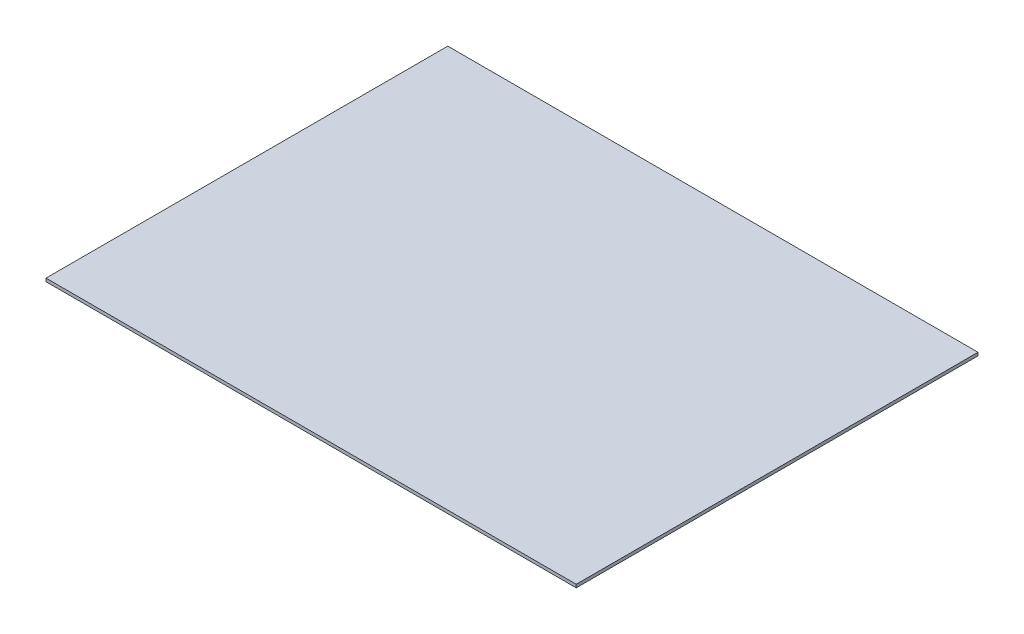
from build123d import *

# Parameters (mm, degrees)
SKETCH1_W           = 536.999999944
SKETCH1_H           = 406.908
BOSS_EXTRUDE1_DEPTH = 3.175


with BuildPart() as part:
    # Sketch1 → Boss-Extrude1 (new body)
    with BuildSketch(Plane(origin=(0, 0, 0), x_dir=(1, 0, 0), z_dir=(0, 1, 0))):
        Rectangle(SKETCH1_W, SKETCH1_H)
    extrude(amount=BOSS_EXTRUDE1_DEPTH)


solid = part.part
